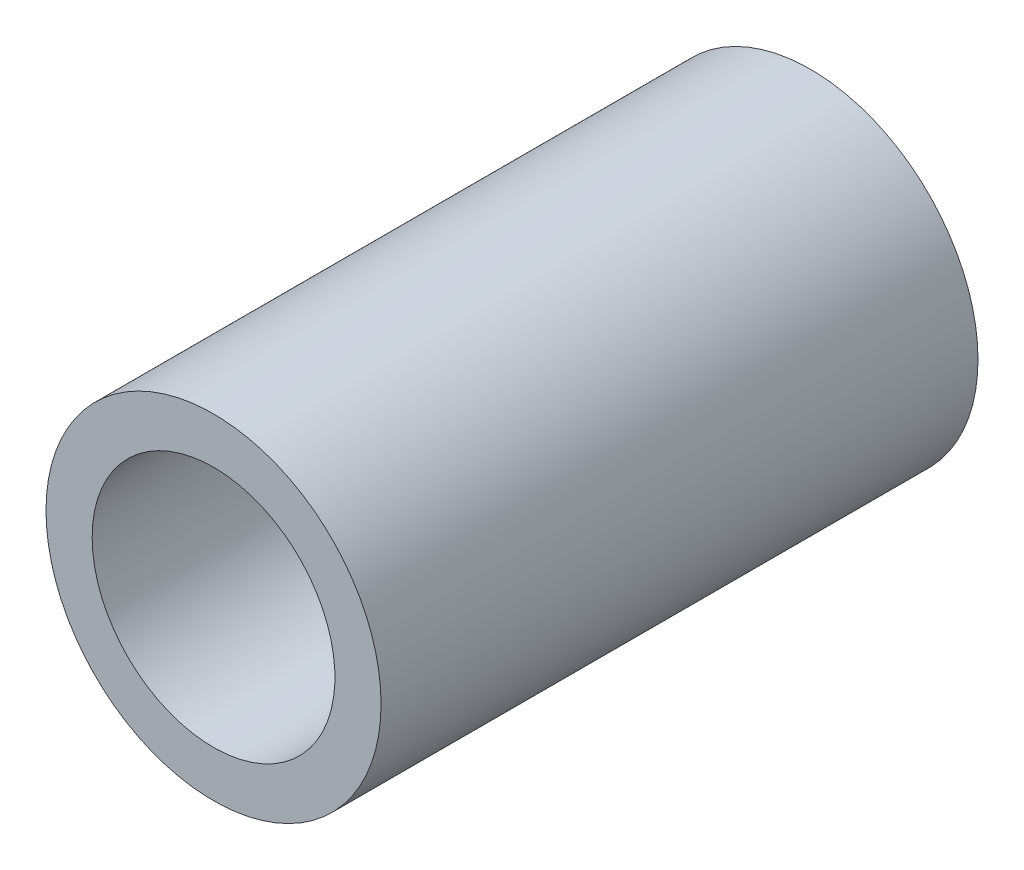
from build123d import *

# Parameters (mm, degrees)
SKETCH1_R           = 10.6934
SKETCH1_R_2         = 7.747
BOSS_EXTRUDE1_DEPTH = 38.1


with BuildPart() as part:
    # Sketch1 → Boss-Extrude1 (new body)
    with BuildSketch(Plane.XY):
        with Locations(Location((0, 0, 0), (0, 0, 180))):
            Circle(SKETCH1_R)
        with Locations(Location((0, 0, 0), (0, 0, 180))):
            Circle(SKETCH1_R_2, mode=Mode.SUBTRACT)
    extrude(amount=BOSS_EXTRUDE1_DEPTH)


solid = part.part
